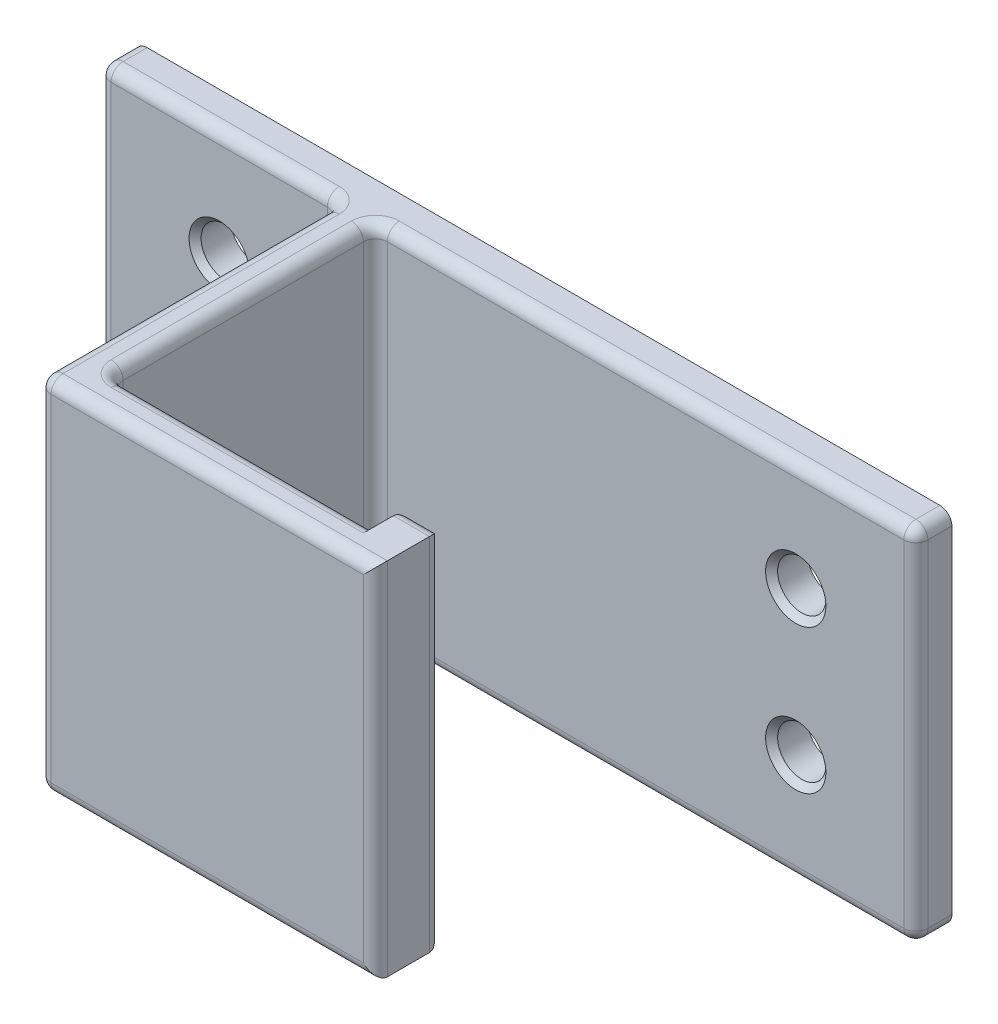
from build123d import *

# Parameters (mm, degrees)
SKETCH1_W                        = 86.36
SKETCH1_H                        = 38.1
BOSS_EXTRUDE1_DEPTH              = 3.81
SKETCH2_W                        = 3.81
SKETCH2_H                        = 38.1
BOSS_EXTRUDE2_DEPTH              = 31.75
SKETCH3_W                        = 3.81
SKETCH3_H                        = 38.1
BOSS_EXTRUDE3_DEPTH              = 31.75
SKETCH4_W                        = 3.81
SKETCH4_H                        = 38.1
BOSS_EXTRUDE4_DEPTH              = 3.175
FILLET1_R                        = 1.27
F_10_CLEARANCE_HOLE1_D           = 5.1054
F_10_CLEARANCE_HOLE1_CSINK_D     = 6.3754
F_10_CLEARANCE_HOLE1_CSINK_ANGLE = 90


with BuildPart() as part:
    # Sketch1 → Boss-Extrude1 (new body)
    with BuildSketch(Plane.XY):
        with Locations((-43.18, 19.05)):
            Rectangle(SKETCH1_W, SKETCH1_H)
    extrude(amount=BOSS_EXTRUDE1_DEPTH)

    # Sketch2 → Boss-Extrude2 (add)
    with BuildSketch(Plane.XY.offset(3.81)):
        with Locations((-59.055, 19.05)):
            Rectangle(SKETCH2_W, SKETCH2_H)
    extrude(amount=BOSS_EXTRUDE2_DEPTH)

    # Sketch3 → Boss-Extrude3 (add)
    with BuildSketch(Plane(origin=(-57.15, 0, 0), x_dir=(0, 0, -1), z_dir=(1, 0, 0))):
        with Locations((-33.655, 19.05)):
            Rectangle(SKETCH3_W, SKETCH3_H)
    extrude(amount=BOSS_EXTRUDE3_DEPTH)

    # Sketch4 → Boss-Extrude4 (add)
    with BuildSketch(Plane(origin=(0, 0, 31.75), x_dir=(-1, 0, 0), z_dir=(0, 0, -1))):
        with Locations((27.305, 19.05)):
            Rectangle(SKETCH4_W, SKETCH4_H)
    extrude(amount=BOSS_EXTRUDE4_DEPTH)

    # Fillet1
    fillet1_edges = [part.edges().sort_by_distance(p)[0] for p in [
        (-86.36, 19.05, 3.81),
        (-73.66, 38.1, 3.81),
        (-28.575, 0, 3.81),
        (-57.15, 19.05, 3.81),
        (-60.96, 19.05, 3.81),
        (-73.66, 0, 3.81),
        (-60.96, 38.1, 19.685),
        (-60.96, 0, 19.685),
        (-43.18, 38.1, 35.56),
        (-60.96, 19.05, 35.56),
        (-43.18, 0, 35.56),
        (-57.15, 38.1, 17.78),
        (-57.15, 0, 17.78),
        (-57.15, 19.05, 31.75),
        (-25.4, 19.05, 35.56),
        (-43.18, 38.1, 31.75),
        (-43.18, 0, 31.75),
        (-25.4, 19.05, 28.575),
        (-27.305, 0, 28.575),
        (-29.21, 19.05, 28.575),
        (-27.305, 38.1, 28.575),
        (0, 19.05, 3.81),
        (0, 0, 1.905),
        (-86.36, 0, 1.905),
        (-86.36, 38.1, 1.905),
        (0, 38.1, 1.905),
        (-28.575, 38.1, 3.81),
    ]]
    fillet(fillet1_edges, radius=FILLET1_R)

    # #10 Clearance Hole1 (through all)
    with Locations(Plane.XY.offset(3.81)):
        with Locations((-73.66, 11.43), (-73.66, 26.67), (-12.7, 11.43), (-12.7, 26.67)):
            CounterSinkHole(F_10_CLEARANCE_HOLE1_D / 2, F_10_CLEARANCE_HOLE1_CSINK_D / 2, counter_sink_angle=F_10_CLEARANCE_HOLE1_CSINK_ANGLE)


solid = part.part
